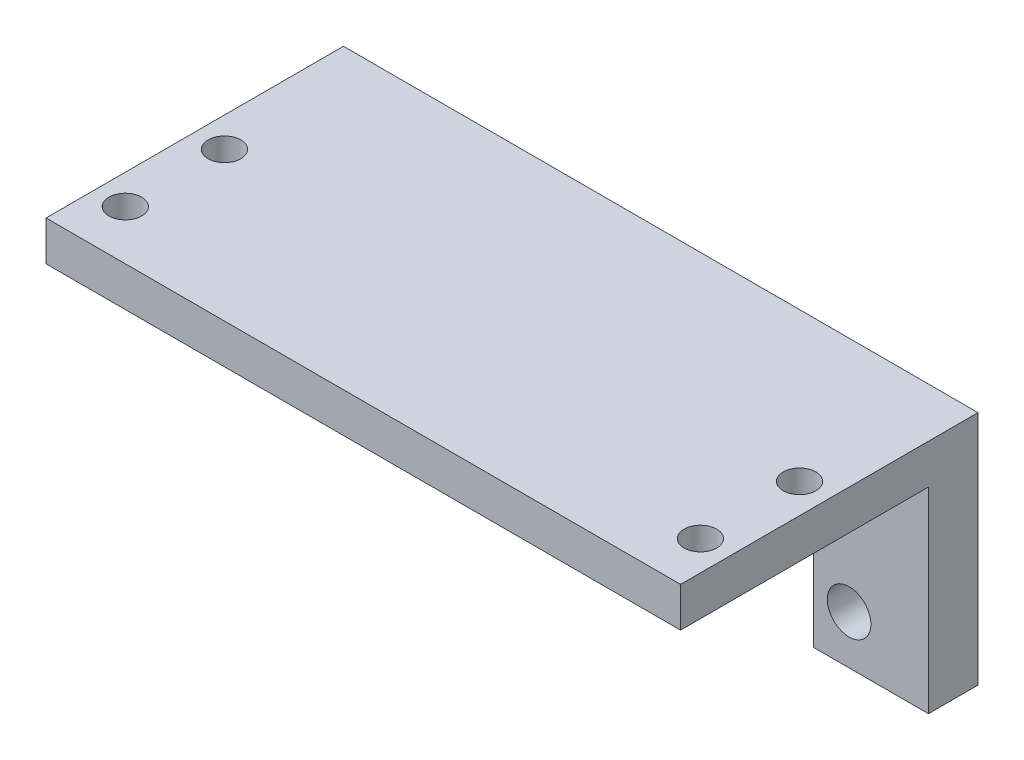
from build123d import *

# Parameters (mm, degrees)
SKETCH_1_W        = 11.6
SKETCH_1_H        = 19.8
SKETCH_1_R        = 2.2
EXTRUDE_1_DEPTH   = 5
EXTRUDE_1_2_DEPTH = 5
SKETCH_3_W        = 64
SKETCH_3_H        = 30
SKETCH_3_R        = 1.65
EXTRUDE_2_DEPTH   = 4


with BuildPart() as part:
    # 草图1 → 凸台-拉伸1 (new body)
    with BuildSketch(Plane.XY):
        with Locations((26.2, -9.9)):
            Rectangle(SKETCH_1_W, SKETCH_1_H)
        with Locations((24, -4.9)):
            Circle(SKETCH_1_R, mode=Mode.SUBTRACT)
        with Locations(Location((24, -14.9, 0), (0, 0, 180))):
            Circle(SKETCH_1_R, mode=Mode.SUBTRACT)
    extrude(amount=EXTRUDE_1_DEPTH)



with BuildPart() as body_2:
    # 草图1 → Extrude 1 2 (new body)
    with BuildSketch(Plane.XY):
        with Locations((-26.2, -9.9)):
            Rectangle(SKETCH_1_W, SKETCH_1_H)
        with Locations((-24, -14.9)):
            Circle(SKETCH_1_R, mode=Mode.SUBTRACT)
        with Locations(Location((-24, -4.9, 0), (0, 0, 180))):
            Circle(SKETCH_1_R, mode=Mode.SUBTRACT)
    extrude(amount=EXTRUDE_1_2_DEPTH)


with BuildPart() as part_1:
    add(part.part)

    add(body_2.part)  # 凸台-拉伸2 merges body 2
    # 草图3 → 凸台-拉伸2 (add)
    with BuildSketch(Plane(origin=(0, 0, 0), x_dir=(1, 0, 0), z_dir=(0, 1, 0))):
        with Locations((0, -15)):
            Rectangle(SKETCH_3_W, SKETCH_3_H)
        with Locations(Location((-29, -15, 0), (0, 0, 270))):
            Circle(SKETCH_3_R, mode=Mode.SUBTRACT)
        with Locations(Location((-29, -25, 0), (0, 0, 270))):
            Circle(SKETCH_3_R, mode=Mode.SUBTRACT)
        with Locations(Location((29, -25, 0), (0, 0, 90))):
            Circle(SKETCH_3_R, mode=Mode.SUBTRACT)
        with Locations(Location((29, -15, 0), (0, 0, 90))):
            Circle(SKETCH_3_R, mode=Mode.SUBTRACT)
    extrude(amount=EXTRUDE_2_DEPTH)


solid = part_1.part
